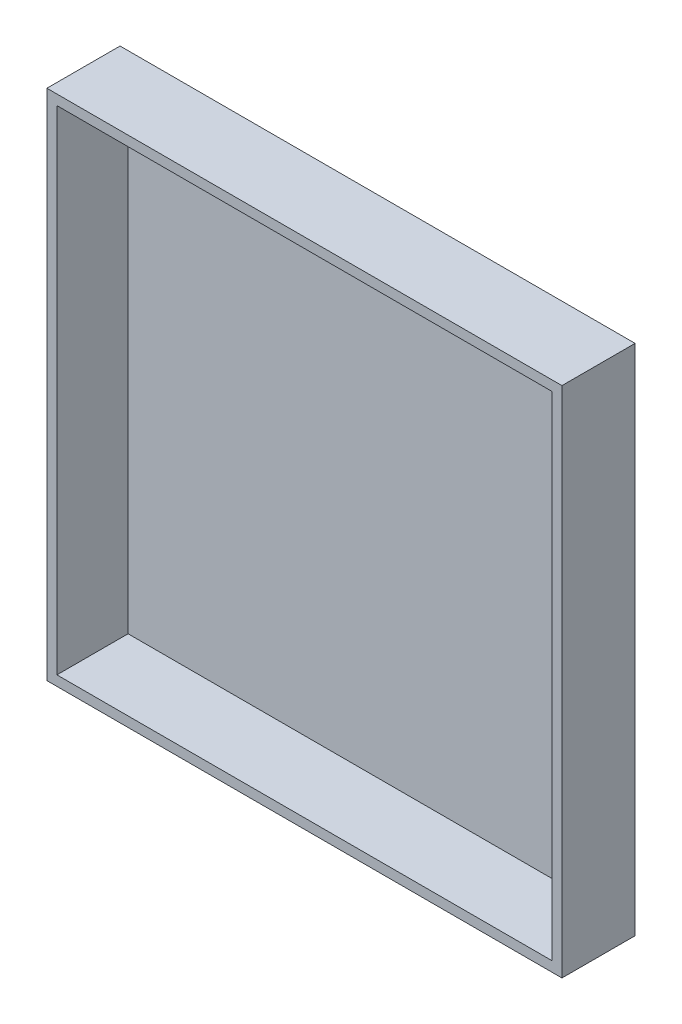
from build123d import *

# Parameters (mm, degrees)
SKETCH1_W           = 514
SKETCH1_H           = 512
SKETCH1_W_2         = 494
SKETCH1_H_2         = 492
EXTRUDE_THIN1_DEPTH = 71
SKETCH2_W           = 514
SKETCH2_H           = 512
BOSS_EXTRUDE1_DEPTH = 2


with BuildPart() as part:
    # Sketch1 → Extrude-Thin1 (new body)
    with BuildSketch(Plane.XY):
        Rectangle(SKETCH1_W, SKETCH1_H)
        Rectangle(SKETCH1_W_2, SKETCH1_H_2, mode=Mode.SUBTRACT)
    extrude(amount=EXTRUDE_THIN1_DEPTH)

    # Sketch2 → Boss-Extrude1 (add)
    with BuildSketch(Plane.XY):
        Rectangle(SKETCH2_W, SKETCH2_H)
    extrude(amount=-BOSS_EXTRUDE1_DEPTH)


solid = part.part
